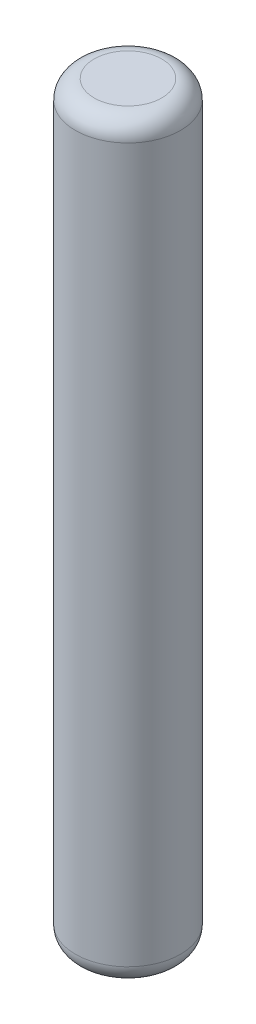
from build123d import *

# Parameters (mm, degrees)
SKETCH1_R           = 1.778
BOSS_EXTRUDE1_DEPTH = 25.4
FILLET2_R           = 0.635


with BuildPart() as part:
    # Sketch1 → Boss-Extrude1 (new body)
    with BuildSketch(Plane(origin=(0, 0, 0), x_dir=(1, 0, 0), z_dir=(0, 1, 0))):
        with Locations(Location((0, 0, 0), (0, 0, 270))):
            Circle(SKETCH1_R)
    extrude(amount=BOSS_EXTRUDE1_DEPTH)

    # Fillet2
    fillet2_edges = [part.edges().sort_by_distance(p)[0] for p in [
        (0, 0, -1.778),
        (0, 25.4, -1.778),
    ]]
    fillet(fillet2_edges, radius=FILLET2_R)


solid = part.part
